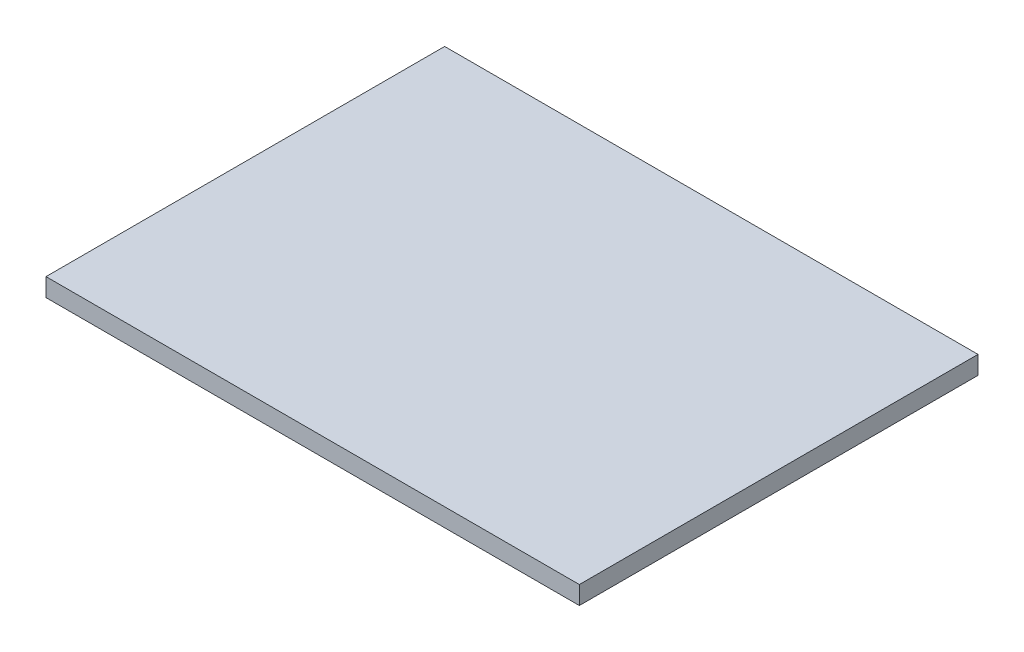
from build123d import *

# Parameters (mm, degrees)
SZKIC1_W                    = 293
SZKIC1_H                    = 219
DODANIE_WYCI_GNI_CIE1_DEPTH = 10


with BuildPart() as part:
    # Szkic1 → Dodanie-wyciągnięcie1 (new body)
    with BuildSketch(Plane(origin=(0, 0, 0), x_dir=(1, 0, 0), z_dir=(0, 1, 0))):
        Rectangle(SZKIC1_W, SZKIC1_H)
    extrude(amount=DODANIE_WYCI_GNI_CIE1_DEPTH)


solid = part.part
